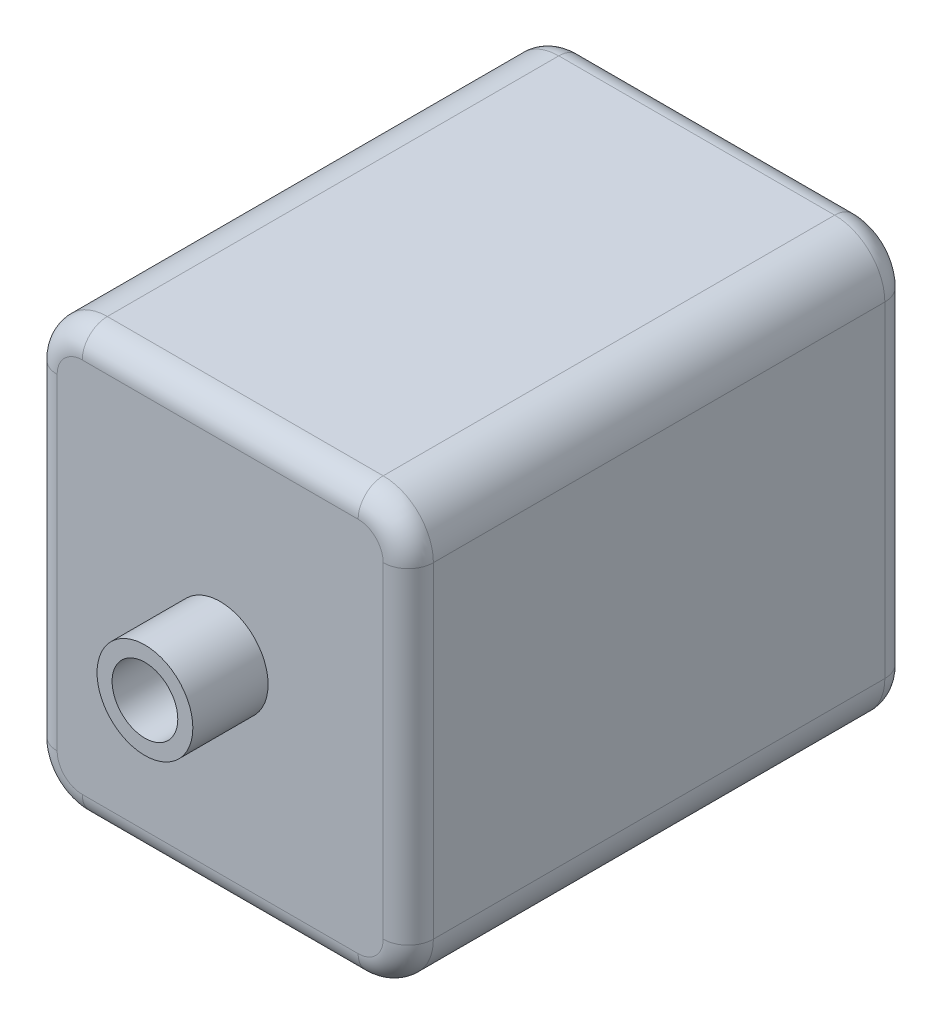
from build123d import *

# Parameters (mm, degrees)
BOSS_EXTRUDE1_DEPTH = 100
BOSS_EXTRUDE2_DEPTH = 3
BOSS_EXTRUDE3_START = -2
BOSS_EXTRUDE3_DEPTH = 2
FILLET2_R           = 5
SKETCH5_R           = 9.55
SKETCH5_R_2         = 6.55
BOSS_EXTRUDE4_DEPTH = 15


with BuildPart() as part:
    # Sketch1 → Boss-Extrude1 (new body)
    with BuildSketch(Plane.XY):
        with BuildLine():
            Line((-20, -46.992716482), (35, -46.992716482))
            ThreePointArc((35, -46.992716482), (42.071067812, -44.063784293), (45, -36.992716482))
            Line((45, -36.992716482), (45, 28.007283518))
            ThreePointArc((45, 28.007283518), (42.071067812, 35.07835133), (35, 38.007283518))
            Line((35, 38.007283518), (-20, 38.007283518))
            ThreePointArc((-20, 38.007283518), (-27.071067812, 35.07835133), (-30, 28.007283518))
            Line((-30, 28.007283518), (-30, -36.992716482))
            ThreePointArc((-30, -36.992716482), (-27.071067812, -44.063784293), (-20, -46.992716482))
        make_face()
        with BuildLine():
            Line((-20, -44.992716482), (35, -44.992716482))
            ThreePointArc((35, -44.992716482), (40.656854249, -42.649570731), (43, -36.992716482))
            Line((43, -36.992716482), (43, 28.007283518))
            ThreePointArc((43, 28.007283518), (40.656854249, 33.664137768), (35, 36.007283518))
            Line((35, 36.007283518), (-20, 36.007283518))
            ThreePointArc((-20, 36.007283518), (-25.656854249, 33.664137768), (-28, 28.007283518))
            Line((-28, 28.007283518), (-28, -36.992716482))
            ThreePointArc((-28, -36.992716482), (-25.656854249, -42.649570731), (-20, -44.992716482))
        make_face(mode=Mode.SUBTRACT)
    extrude(amount=BOSS_EXTRUDE1_DEPTH)

    # Sketch2 → Boss-Extrude2 (add)
    with BuildSketch(Plane(origin=(0, 0, 0), x_dir=(-1, 0, 0), z_dir=(0, 0, -1))):
        with BuildLine():
            Line((-35, -46.992716482), (20, -46.992716482))
            ThreePointArc((20, -46.992716482), (27.071067812, -44.063784293), (30, -36.992716482))
            Line((30, -36.992716482), (30, 28.007283518))
            ThreePointArc((30, 28.007283518), (27.071067812, 35.07835133), (20, 38.007283518))
            Line((20, 38.007283518), (-35, 38.007283518))
            ThreePointArc((-35, 38.007283518), (-42.071067812, 35.07835133), (-45, 28.007283518))
            Line((-45, 28.007283518), (-45, -36.992716482))
            ThreePointArc((-45, -36.992716482), (-42.071067812, -44.063784293), (-35, -46.992716482))
        make_face()
    extrude(amount=-BOSS_EXTRUDE2_DEPTH)

    # Sketch4 → Boss-Extrude3 (add)
    with BuildSketch(Plane.XY.offset(100).offset(BOSS_EXTRUDE3_START)):
        with BuildLine():
            Line((-20, -46.992716482), (35, -46.992716482))
            ThreePointArc((35, -46.992716482), (42.071067812, -44.063784293), (45, -36.992716482))
            Line((45, -36.992716482), (45, 28.007283518))
            ThreePointArc((45, 28.007283518), (42.071067812, 35.07835133), (35, 38.007283518))
            Line((35, 38.007283518), (-20, 38.007283518))
            ThreePointArc((-20, 38.007283518), (-27.071067812, 35.07835133), (-30, 28.007283518))
            Line((-30, 28.007283518), (-30, -36.992716482))
            ThreePointArc((-30, -36.992716482), (-27.071067812, -44.063784293), (-20, -46.992716482))
        make_face()
    extrude(amount=BOSS_EXTRUDE3_DEPTH)

    # Fillet2
    fillet2_edges = [part.edges().sort_by_distance(p)[0] for p in [
        (7.5, 38.007283518, 0),
        (-28, -4.492716482, 98),
        (-25.656854249, -42.649570731, 98),
        (7.5, -44.992716482, 98),
        (40.656854249, -42.649570731, 98),
        (43, -4.492716482, 98),
        (40.656854249, 33.664137768, 98),
        (42.071067812, 35.07835133, 0),
        (7.5, 36.007283518, 98),
        (-25.656854249, 33.664137768, 98),
        (45, -4.492716482, 0),
        (42.071067812, -44.063784293, 0),
        (42.071067812, 35.07835133, 100),
        (7.5, 38.007283518, 100),
        (-27.071067812, 35.07835133, 100),
        (-30, -4.492716482, 100),
        (-27.071067812, -44.063784293, 100),
        (7.5, -46.992716482, 100),
        (42.071067812, -44.063784293, 100),
        (-28, -4.492716482, 3),
        (7.5, -44.992716482, 3),
        (-25.656854249, -42.649570731, 3),
        (-25.656854249, 33.664137768, 3),
        (7.5, 36.007283518, 3),
        (40.656854249, 33.664137768, 3),
        (43, -4.492716482, 3),
        (40.656854249, -42.649570731, 3),
        (7.5, -46.992716482, 0),
        (45, -4.492716482, 100),
        (-27.071067812, -44.063784293, 0),
        (-30, -4.492716482, 0),
        (-27.071067812, 35.07835133, 0),
    ]]
    fillet(fillet2_edges, radius=FILLET2_R)

    # Sketch5 → Boss-Extrude4 (add)
    with BuildSketch(Plane.XY.offset(100)):
        with Locations((7.5, -4.492716482)):
            Circle(SKETCH5_R)
        with Locations((7.5, -4.492716482)):
            Circle(SKETCH5_R_2, mode=Mode.SUBTRACT)
    extrude(amount=BOSS_EXTRUDE4_DEPTH)


solid = part.part
